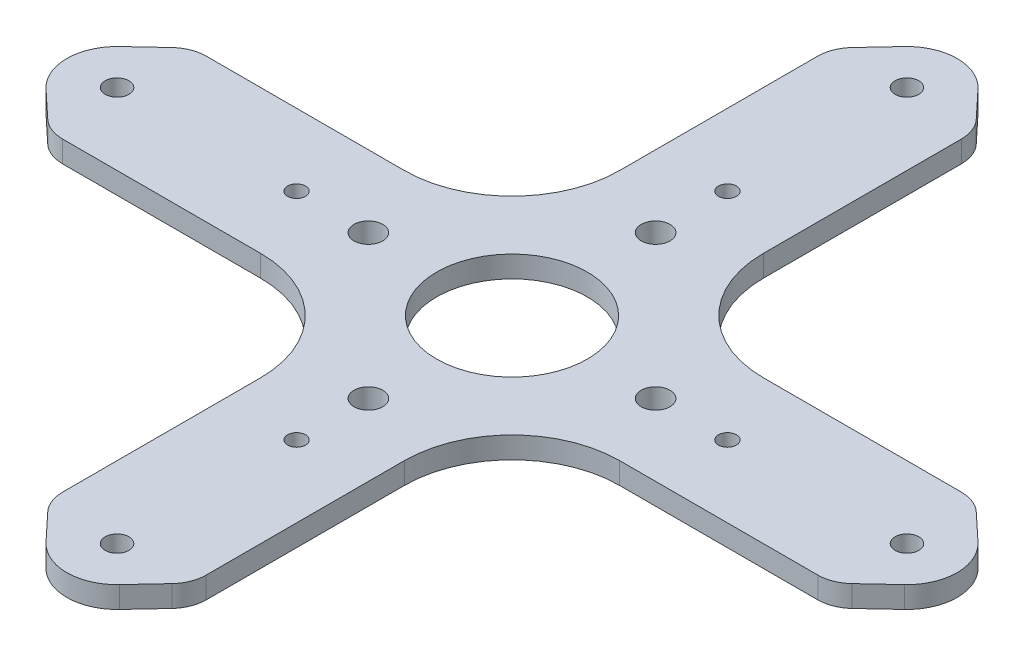
from build123d import *

# Parameters (mm, degrees)
SKETCH1_R             = 2
SKETCH1_R_2           = 10.5
BOSS_EXTRUDE1_DEPTH   = 3
FILLET1_R             = 15
FILLET2_R             = 5
M4X0_7_TAPPED_HOLE1_D = 3.3
M3X0_5_TAPPED_HOLE1_D = 2.5


with BuildPart() as part:
    # Sketch1 → Boss-Extrude1 (new body)
    with BuildSketch(Plane(origin=(0, 0, 0), x_dir=(1, 0, 0), z_dir=(0, 1, 0))):
        with BuildLine():
            Line((10, 10), (54.556312231, 10))
            Line((54.556312231, 10), (59.781818182, 5.112163424))
            ThreePointArc((59.781818182, 5.112163424), (62, 0), (59.781818182, -5.112163424))
            Line((59.781818182, -5.112163424), (54.556312231, -10))
            Line((54.556312231, -10), (10, -10))
            Line((10, -10), (10, -54.556312231))
            Line((10, -54.556312231), (5.112163424, -59.781818182))
            ThreePointArc((5.112163424, -59.781818182), (0, -62), (-5.112163424, -59.781818182))
            Line((-5.112163424, -59.781818182), (-10, -54.556312231))
            Line((-10, -54.556312231), (-10, -10))
            Line((-10, -10), (-54.556312231, -10))
            Line((-54.556312231, -10), (-59.781818182, -5.112163424))
            ThreePointArc((-59.781818182, -5.112163424), (-62, 0), (-59.781818182, 5.112163424))
            Line((-59.781818182, 5.112163424), (-54.556312231, 10))
            Line((-54.556312231, 10), (-10, 10))
            Line((-10, 10), (-10, 54.556312231))
            Line((-10, 54.556312231), (-5.112163424, 59.781818182))
            ThreePointArc((-5.112163424, 59.781818182), (0, 62), (5.112163424, 59.781818182))
            Line((5.112163424, 59.781818182), (10, 54.556312231))
            Line((10, 54.556312231), (10, 10))
        make_face()
        with Locations(Location((-20, 0, 0), (0, 0, 270))):
            Circle(SKETCH1_R, mode=Mode.SUBTRACT)
        with Locations(Location((0, 20, 0), (0, 0, 270))):
            Circle(SKETCH1_R, mode=Mode.SUBTRACT)
        with Locations(Location((20, 0, 0), (0, 0, 270))):
            Circle(SKETCH1_R, mode=Mode.SUBTRACT)
        with Locations(Location((0, -20, 0), (0, 0, 270))):
            Circle(SKETCH1_R, mode=Mode.SUBTRACT)
        with Locations(Location((0, 0, 0), (0, 0, 270))):
            Circle(SKETCH1_R_2, mode=Mode.SUBTRACT)
    extrude(amount=BOSS_EXTRUDE1_DEPTH)

    # Fillet1
    fillet1_edges = [part.edges().sort_by_distance(p)[0] for p in [
        (10, 1.5, -10),
        (10, 1.5, 10),
        (-10, 1.5, 10),
        (-10, 1.5, -10),
    ]]
    fillet(fillet1_edges, radius=FILLET1_R)

    # Fillet2
    fillet2_edges = [part.edges().sort_by_distance(p)[0] for p in [
        (54.556312231, 1.5, -10),
        (54.556312231, 1.5, 10),
        (10, 1.5, 54.556312231),
        (-10, 1.5, 54.556312231),
        (-54.556312231, 1.5, 10),
        (-54.556312231, 1.5, -10),
        (-10, 1.5, -54.556312231),
        (10, 1.5, -54.556312231),
    ]]
    fillet(fillet2_edges, radius=FILLET2_R)

    # M4x0.7 Tapped Hole1 (through all)
    with Locations(Plane(origin=(0, 0, 0), x_dir=(-1, 0, 0), z_dir=(0, -1, 0))):
        with Locations((0, -55), (-55, 0), (0, 55), (55, 0)):
            Hole(M4X0_7_TAPPED_HOLE1_D / 2)

    # M3x0.5 Tapped Hole1 (through all)
    with Locations(Plane(origin=(0, 0, 0), x_dir=(-1, 0, 0), z_dir=(0, -1, 0))):
        with Locations((0, -30), (-30, 0), (0, 30), (30, 0), (0, 0)):
            Hole(M3X0_5_TAPPED_HOLE1_D / 2)


solid = part.part
